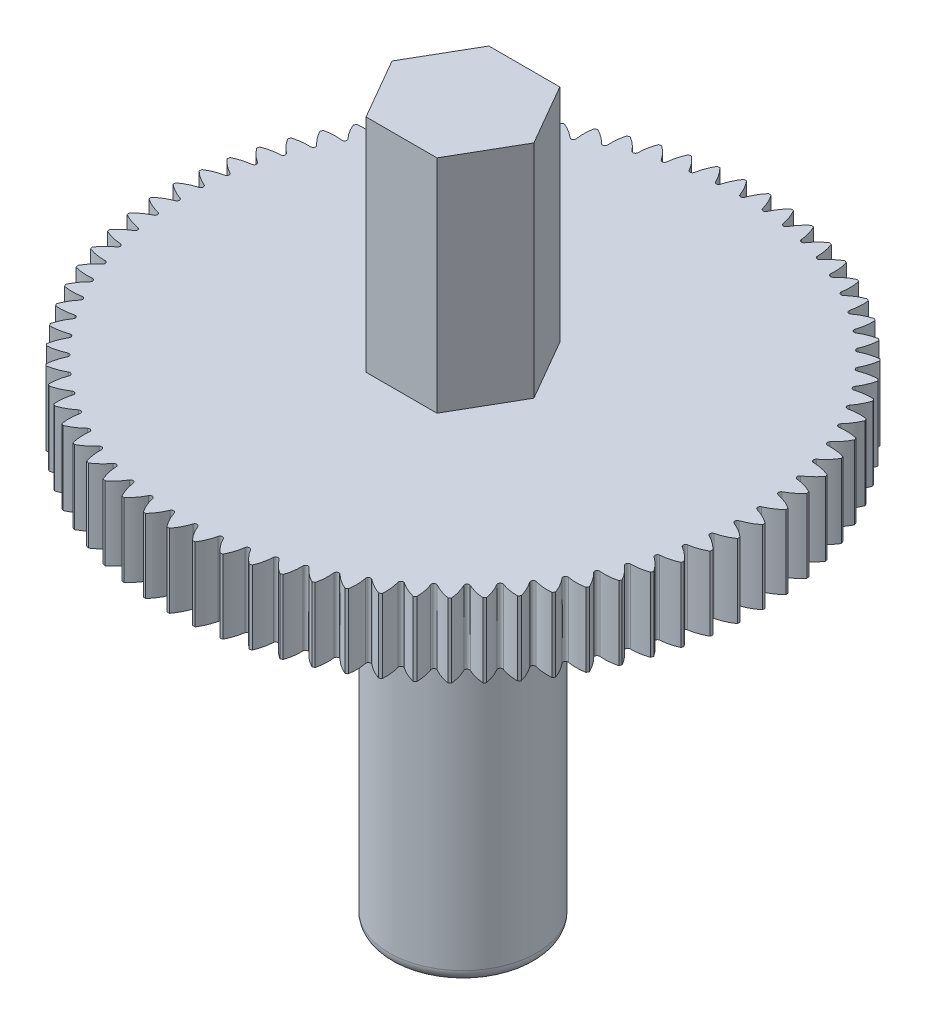
from build123d import *

# Parameters (mm, degrees)
RADYUS1_R               = 0.5
IZIM3_OUTSIDE_W         = 34.928
IZIM3_OUTSIDE_H         = 34.928
KES_EKSTR_ZYON1_DEPTH   = 9
KES_EKSTR_ZYON2_DEPTH   = 4
DAIRESEL_KAPLAMA1_COUNT = 75


with BuildPart() as part:
    # Çizim2 → Döndür1 (revolve)
    with BuildSketch(Plane.XY, mode=Mode.PRIVATE) as d_nd_r1_sk:
        Polygon((0, 0), (3, 0), (3, 17), (12, 17), (12, 20), (3, 20), (3, 29), (0, 29), align=None)
    revolve(d_nd_r1_sk.sketch.rotate(Axis((0, 29, 0), (0, -1, 0)), 180), axis=Axis((0, 29, 0), (0, -1, 0)))

    # Radyus1
    radyus1_edges = [part.edges().sort_by_distance(p)[0] for p in [
        (3, 0, 0),
    ]]
    fillet(radyus1_edges, radius=RADYUS1_R)

    # Çizim3 outside → Kes-Ekstrüzyon1 (cut)
    with BuildSketch(Plane(origin=(0, 29, 0), x_dir=(1, 0, 0), z_dir=(0, 1, 0))):
        Rectangle(IZIM3_OUTSIDE_W, IZIM3_OUTSIDE_H)
        Polygon((1.443375673, -2.5), (2.886751346, 0), (1.443375673, 2.5), (-1.443375673, 2.5), (-2.886751346, 0), (-1.443375673, -2.5), align=None, mode=Mode.SUBTRACT)
    extrude(amount=-KES_EKSTR_ZYON1_DEPTH, mode=Mode.SUBTRACT)

    # Çizim4 → Kes-Ekstrüzyon2 (cut)
    with BuildSketch(Plane(origin=(0, 20, 0), x_dir=(1, 0, 0), z_dir=(0, 1, 0))):
        with BuildLine():
            Line((0, 12), (0, 11.306129062))
            ThreePointArc((0, 11.306129062), (0.057836107, 11.324235794), (0.09459348, 11.372420486))
            ThreePointArc((0.09459348, 11.372420486), (0.24478154, 11.697784654), (0.45, 11.991559532))
            ThreePointArc((0.45, 11.991559532), (0.225039575, 11.997889697), (0, 12))
        make_face()
        with BuildLine():
            ThreePointArc((-0.093739442, 11.372525192), (-0.057354473, 11.324524536), (0, 11.306129062))
            Line((0, 11.306129062), (0, 12))
            ThreePointArc((0, 12), (-0.225039575, 11.997889697), (-0.45, 11.991559532))
            ThreePointArc((-0.45, 11.991559532), (-0.244012559, 11.698074442), (-0.093739442, 11.372525192))
        make_face()
    kes_ekstr_zyon2 = extrude(amount=-KES_EKSTR_ZYON2_DEPTH, mode=Mode.SUBTRACT)

    # Dairesel Kaplama1: Kes-Ekstrüzyon2 ×75 about axis
    dairesel_kaplama1_axis = Axis((0, 0, 0), (0, 1, 0))
    for i in range(1, DAIRESEL_KAPLAMA1_COUNT):
        add(kes_ekstr_zyon2.rotate(dairesel_kaplama1_axis, i * 360 / DAIRESEL_KAPLAMA1_COUNT), mode=Mode.SUBTRACT)


solid = part.part
